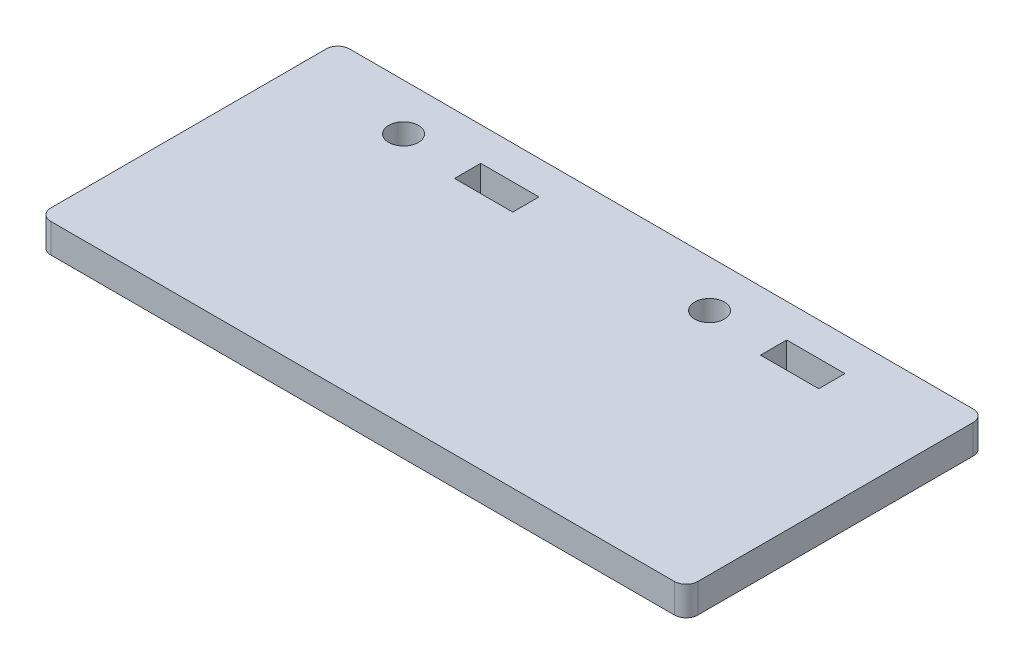
from build123d import *

# Parameters (mm, degrees)
SKETCH1_W           = 111.1
SKETCH1_H           = 51.3
BOSS_EXTRUDE1_DEPTH = 5
SKETCH9_W           = 5
SKETCH9_H           = 4
BOSS_EXTRUDE5_DEPTH = 3
SKETCH10_R          = 2.55
SKETCH10_W          = 10
SKETCH10_H          = 4.5
CUT_EXTRUDE1_DEPTH  = 10
SKETCH11_R          = 1.8
CUT_EXTRUDE2_DEPTH  = 3
FILLET1_R           = 2


with BuildPart() as part:
    # Sketch1 → Boss-Extrude1 (new body)
    with BuildSketch(Plane(origin=(0, 0, 0), x_dir=(1, 0, 0), z_dir=(0, 1, 0))):
        Rectangle(SKETCH1_W, SKETCH1_H)
    extrude(amount=BOSS_EXTRUDE1_DEPTH)

    # Sketch9 → Boss-Extrude5 (add)
    with BuildSketch(Plane.XZ):
        with Locations((-48.05, -20.65)):
            Rectangle(SKETCH9_W, SKETCH9_H)
        with Locations((48.05, -20.65)):
            Rectangle(SKETCH9_W, SKETCH9_H)
    extrude(amount=BOSS_EXTRUDE5_DEPTH)

    # Sketch10 → Cut-Extrude1 (cut)
    with BuildSketch(Plane(origin=(0, 5, 0), x_dir=(1, 0, 0), z_dir=(0, 1, 0))):
        with Locations(Location((-36.275, 17.65, 0), (0, 0, 270))):
            Circle(SKETCH10_R)
        with Locations(Location((16.275, 17.65, 0), (0, 0, 270))):
            Circle(SKETCH10_R)
        with Locations((-20.275, 17.65)):
            Rectangle(SKETCH10_W, SKETCH10_H)
        with Locations((32.275, 17.65)):
            Rectangle(SKETCH10_W, SKETCH10_H)
    extrude(amount=-CUT_EXTRUDE1_DEPTH, mode=Mode.SUBTRACT)

    # Sketch11 → Cut-Extrude2 (cut)
    with BuildSketch(Plane.XZ):
        with Locations(Location((-30.025, -17.65, 0), (0, 0, 270))):
            Circle(SKETCH11_R)
        with Locations(Location((-10.525, -17.65, 0), (0, 0, 270))):
            Circle(SKETCH11_R)
        with Locations(Location((22.525, -17.65, 0), (0, 0, 270))):
            Circle(SKETCH11_R)
        with Locations(Location((42.025, -17.65, 0), (0, 0, 270))):
            Circle(SKETCH11_R)
    extrude(amount=-CUT_EXTRUDE2_DEPTH, mode=Mode.SUBTRACT)

    # Fillet1
    fillet1_edges = [part.edges().sort_by_distance(p)[0] for p in [
        (-55.55, 2.5, -25.65),
        (55.55, 2.5, -25.65),
        (55.55, 2.5, 25.65),
        (-55.55, 2.5, 25.65),
    ]]
    fillet(fillet1_edges, radius=FILLET1_R)


solid = part.part
